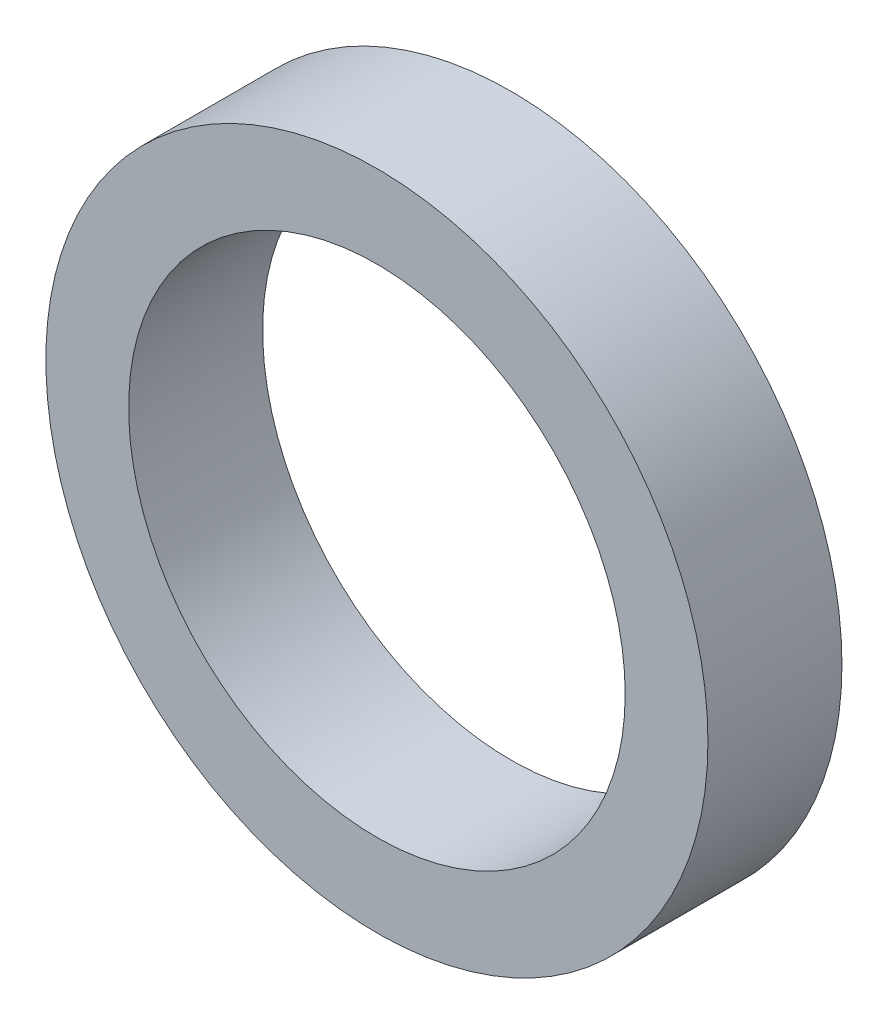
from build123d import *

# Parameters (mm, degrees)
SKETCH1_R           = 4.2
SKETCH1_R_2         = 3.15
BOSS_EXTRUDE1_DEPTH = 1.7


with BuildPart() as part:
    # Sketch1 → Boss-Extrude1 (new body)
    with BuildSketch(Plane.XY):
        Circle(SKETCH1_R)
        Circle(SKETCH1_R_2, mode=Mode.SUBTRACT)
    extrude(amount=BOSS_EXTRUDE1_DEPTH)


solid = part.part
